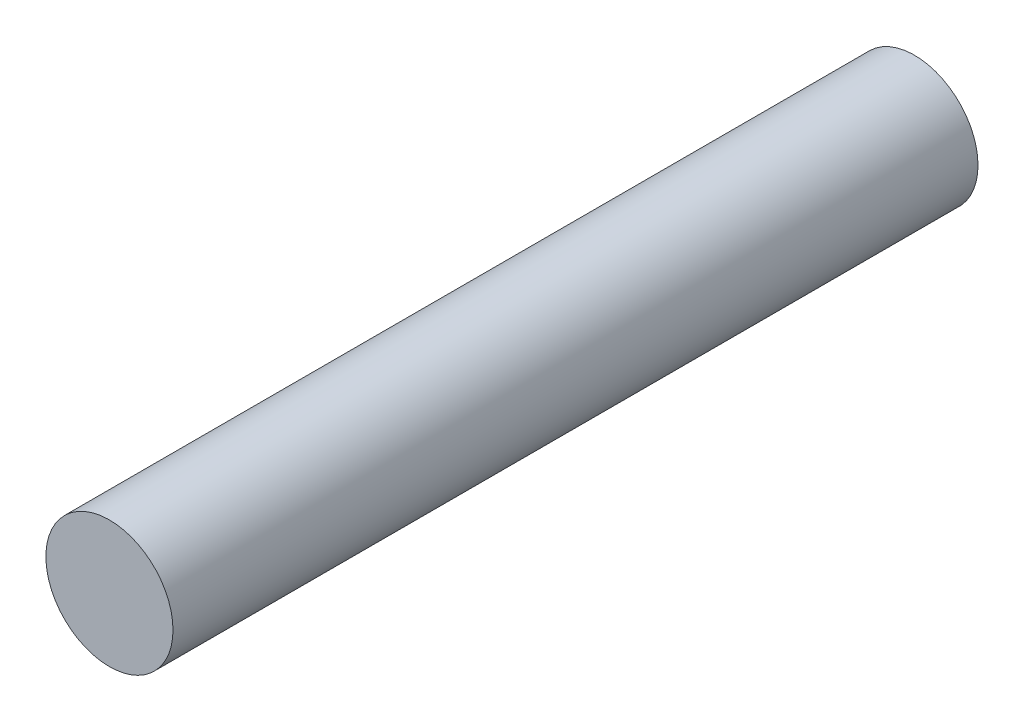
from build123d import *

# Parameters (mm, degrees)
SKETCH1_R           = 30
BOSS_EXTRUDE1_DEPTH = 380


with BuildPart() as part:
    # Sketch1 → Boss-Extrude1 (new body)
    with BuildSketch(Plane.XY):
        Circle(SKETCH1_R)
    extrude(amount=BOSS_EXTRUDE1_DEPTH)


solid = part.part
